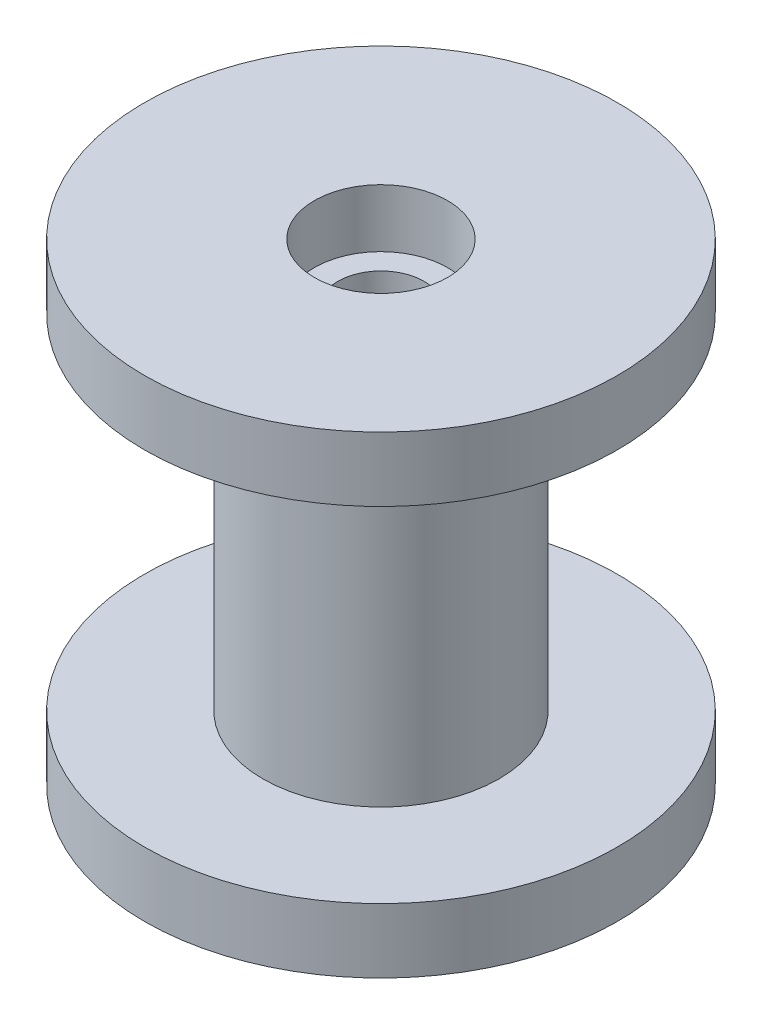
from build123d import *

# Parameters (mm, degrees)
SKETCH_1_R          = 11
EXTRUDE_3_DEPTH     = 11
SKETCH_1_10_R       = 11
SKETCH_1_10_R_2     = 5.5
CUT_EXTRUDE_1_DEPTH = 8
SKETCH_2_R          = 2
CUT_EXTRUDE_2_DEPTH = 27.944387171
SKETCH_2_3_R        = 3.1
CUT_EXTRUDE_3_DEPTH = 2.7
CUT_EXTRUDE_START   = -19.3
SKETCH_2_4_R        = 3.1
CUT_EXTRUDE_4_DEPTH = 2.7


with BuildPart() as part:
    # 草图1 → 凸台-拉伸3 (new, symmetric)
    with BuildSketch(Plane(origin=(0, 0, 0), x_dir=(1, 0, 0), z_dir=(0, 1, 0))):
        with Locations(Location((0, 0, 0), (0, 0, 270))):
            Circle(SKETCH_1_R)
    extrude(amount=EXTRUDE_3_DEPTH, both=True)

    # 草图1<10> → 切除-拉伸1 (cut, symmetric)
    with BuildSketch(Plane(origin=(0, 0, 0), x_dir=(1, 0, 0), z_dir=(0, 1, 0))):
        with Locations(Location((0, 0, 0), (0, 0, 270))):
            Circle(SKETCH_1_10_R)
        with Locations(Location((0, 0, 0), (0, 0, 270))):
            Circle(SKETCH_1_10_R_2, mode=Mode.SUBTRACT)
    extrude(amount=CUT_EXTRUDE_1_DEPTH, both=True, mode=Mode.SUBTRACT)

    # 草图2 → 切除-拉伸2 (cut, through all)
    with BuildSketch(Plane(origin=(0, 11, 0), x_dir=(1, 0, 0), z_dir=(0, 1, 0))):
        with Locations(Location((0, 0, 0), (0, 0, 270))):
            Circle(SKETCH_2_R)
    extrude(amount=-CUT_EXTRUDE_2_DEPTH, mode=Mode.SUBTRACT)

    # 草图2<3> → 切除-拉伸3 (cut)
    with BuildSketch(Plane(origin=(0, 11, 0), x_dir=(1, 0, 0), z_dir=(0, 1, 0))):
        with Locations(Location((0, 0, 0), (0, 0, 270))):
            Circle(SKETCH_2_3_R)
    extrude(amount=-CUT_EXTRUDE_3_DEPTH, mode=Mode.SUBTRACT)

    # 草图2<4> → 切除-拉伸4 (cut)
    with BuildSketch(Plane(origin=(0, 11, 0), x_dir=(1, 0, 0), z_dir=(0, 1, 0)).offset(CUT_EXTRUDE_START)):
        with Locations(Location((0, 0, 0), (0, 0, 270))):
            Circle(SKETCH_2_4_R)
    extrude(amount=-CUT_EXTRUDE_4_DEPTH, mode=Mode.SUBTRACT)


solid = part.part
